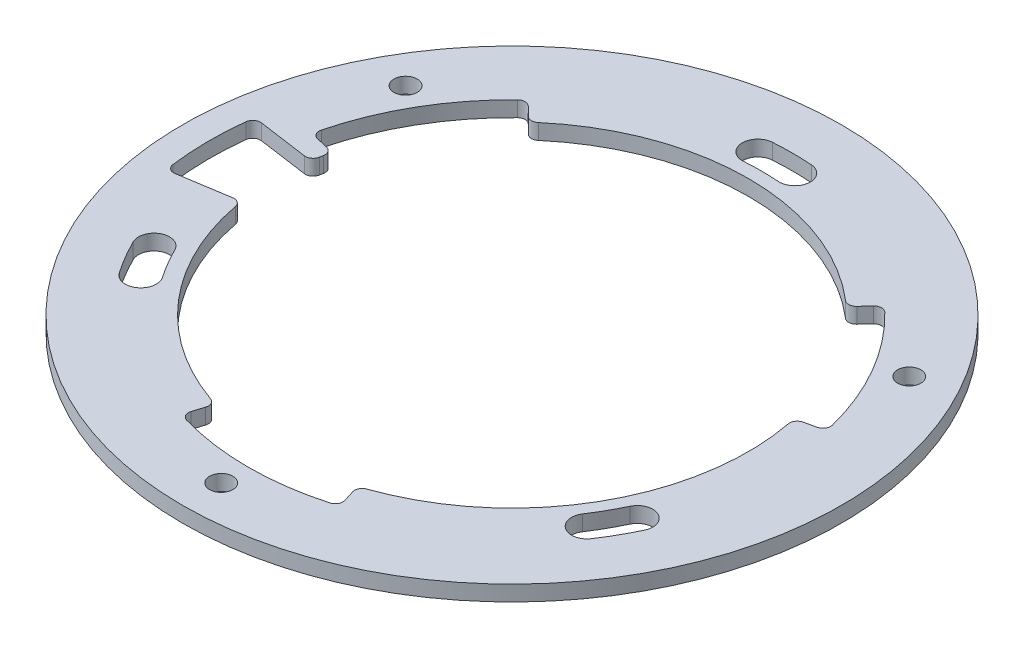
from build123d import *

# Parameters (mm, degrees)
SKETCH1_R           = 42.5
SKETCH1_R_2         = 30.5
SKETCH1_R_3         = 1.5
BOSS_EXTRUDE1_DEPTH = 2
SKETCH2_R           = 1.5
CUT_EXTRUDE1_DEPTH  = 61.137342808
CUT_EXTRUDE2_DEPTH  = 61.137342808
CUT_EXTRUDE3_DEPTH  = 61.137342808
FILLET1_R           = 1


with BuildPart() as part:
    # Sketch1 → Boss-Extrude1 (new body)
    with BuildSketch(Plane(origin=(0, 0, 0), x_dir=(1, 0, 0), z_dir=(0, 1, 0))):
        with Locations(Location((0, 0, 0), (0, 0, 270))):
            Circle(SKETCH1_R)
        with Locations(Location((0, 0, 0), (0, 0, 270))):
            Circle(SKETCH1_R_2, mode=Mode.SUBTRACT)
        with Locations(Location((0, 34.1739971, 0), (0, 0, 270))):
            Circle(SKETCH1_R_3, mode=Mode.SUBTRACT)
        with Locations(Location((-29.672696408, -17.456745562, 0), (0, 0, 270))):
            Circle(SKETCH1_R_3, mode=Mode.SUBTRACT)
        with Locations(Location((29.672696408, -16.717251537, 0), (0, 0, 270))):
            Circle(SKETCH1_R_3, mode=Mode.SUBTRACT)
        with Locations(Location((-32.475952642, 18.75, 0), (0, 0, 270))):
            Circle(SKETCH1_R_3, mode=Mode.SUBTRACT)
        with Locations(Location((0, -37.5, 0), (0, 0, 270))):
            Circle(SKETCH1_R_3, mode=Mode.SUBTRACT)
        with Locations(Location((32.475952642, 18.75, 0), (0, 0, 270))):
            Circle(SKETCH1_R_3, mode=Mode.SUBTRACT)
    extrude(amount=BOSS_EXTRUDE1_DEPTH)

    # Sketch2 → Cut-Extrude1 (cut, through all)
    # profile 1 of 3: a face of its own
    with BuildSketch(Plane(origin=(0, 2, 0), x_dir=(1, 0, 0), z_dir=(0, 1, 0))):
        with BuildLine():
            ThreePointArc((2.523370479, 36.085879061), (0, 36.1739971), (-2.523370479, 36.085879061))
            ThreePointArc((-2.523370479, 36.085879061), (-4.378985632, 33.951238013), (-2.244344584, 32.09562286))
            ThreePointArc((-2.244344584, 32.09562286), (0, 32.1739971), (2.244344584, 32.09562286))
            ThreePointArc((2.244344584, 32.09562286), (4.378985632, 33.951238013), (2.523370479, 36.085879061))
        make_face()
        with Locations((0, 34.1739971)):
            Circle(SKETCH2_R, mode=Mode.SUBTRACT)
    # profile 2 of 3: a face of its own
    with BuildSketch(Plane(origin=(0, 2, 0), x_dir=(1, 0, 0), z_dir=(0, 1, 0))):
        with BuildLine():
            ThreePointArc((-32.608491766, -16.235777693), (-31.396508518, -18.470881554), (-30.031564637, -20.615997137))
            ThreePointArc((-30.031564637, -20.615997137), (-27.250781536, -21.132954915), (-26.733823758, -18.352171814))
            ThreePointArc((-26.733823758, -18.352171814), (-27.948884299, -16.442609571), (-29.027780684, -14.452940586))
            ThreePointArc((-29.027780684, -14.452940586), (-31.709554778, -13.554003599), (-32.608491766, -16.235777693))
        make_face()
        with Locations((-29.672696408, -17.456745562)):
            Circle(SKETCH2_R, mode=Mode.SUBTRACT)
    # profile 3 of 3: a face of its own
    with BuildSketch(Plane(origin=(0, 2, 0), x_dir=(1, 0, 0), z_dir=(0, 1, 0))):
        with BuildLine():
            ThreePointArc((30.104043518, -19.847248501), (31.41518565, -17.69894968), (32.573276155, -15.464423355))
            ThreePointArc((32.573276155, -15.464423355), (31.6243086, -12.799942059), (28.959827303, -13.748909615))
            ThreePointArc((28.959827303, -13.748909615), (27.930207167, -15.735553395), (26.764513869, -17.64553514))
            ThreePointArc((26.764513869, -17.64553514), (27.333422013, -20.416156645), (30.104043518, -19.847248501))
        make_face()
        with Locations((29.672696408, -16.717251537)):
            Circle(SKETCH2_R, mode=Mode.SUBTRACT)
    extrude(amount=-CUT_EXTRUDE1_DEPTH, mode=Mode.SUBTRACT)

    # Sketch3 → Cut-Extrude2 (cut, through all)
    with BuildSketch(Plane(origin=(0, 2, 0), x_dir=(1, 0, 0), z_dir=(0, 1, 0))):
        with BuildLine():
            Line((-29.777028217, 6.601408225), (-33.194064242, 7.358946874))
            ThreePointArc((-33.194064242, 7.358946874), (-29.444863729, 17), (-22.970067059, 25.067429452))
            Line((-22.970067059, 25.067429452), (-20.492564537, 22.58992693))
            ThreePointArc((-20.492564537, 22.58992693), (-26.37548429, 15.316129684), (-29.777028217, 6.601408225))
        make_face()
        with BuildLine():
            Line((20.605501332, 22.486958773), (22.970067059, 25.067429452))
            ThreePointArc((22.970067059, 25.067429452), (29.444863729, 17), (33.194064242, 7.358946874))
            Line((33.194064242, 7.358946874), (29.777028217, 6.601408225))
            ThreePointArc((29.777028217, 6.601408225), (26.413774815, 15.25), (20.605501332, 22.486958773))
        make_face()
        with BuildLine():
            Line((-9.171526885, -29.088366998), (-10.223997183, -32.426376325))
            ThreePointArc((-10.223997183, -32.426376325), (0, -34), (10.223997183, -32.426376325))
            Line((10.223997183, -32.426376325), (9.171526885, -29.088366998))
            ThreePointArc((9.171526885, -29.088366998), (0, -30.5), (-9.171526885, -29.088366998))
        make_face()
    extrude(amount=-CUT_EXTRUDE2_DEPTH, mode=Mode.SUBTRACT)

    # Sketch4 → Cut-Extrude3 (cut, through all)
    with BuildSketch(Plane(origin=(0, 2, 0), x_dir=(1, 0, 0), z_dir=(0, 1, 0))):
        with BuildLine():
            Line((-30.200854727, 4.261264341), (-38.617486372, 5.448829814))
            ThreePointArc((-38.617486372, 5.448829814), (-38.998694951, -0.319048797), (-38.523169542, -6.079918457))
            Line((-38.523169542, -6.079918457), (-30.127094129, -4.754808024))
            ThreePointArc((-30.127094129, -4.754808024), (-30.498979385, -0.249512521), (-30.200854727, 4.261264341))
        make_face()
    extrude(amount=-CUT_EXTRUDE3_DEPTH, mode=Mode.SUBTRACT)

    # Fillet1
    fillet1_edges = [part.edges().sort_by_distance(p)[0] for p in [
        (-20.492564537, 1, -22.58992693),
        (-29.777028217, 1, -6.601408225),
        (-33.194064242, 1, -7.358946874),
        (-22.970067059, 1, -25.067429452),
        (-9.171526885, 1, 29.088366998),
        (9.171526885, 1, 29.088366998),
        (10.223997183, 1, 32.426376325),
        (-10.223997183, 1, 32.426376325),
        (22.970067059, 1, -25.067429452),
        (33.194064242, 1, -7.358946874),
        (29.777028217, 1, -6.601408225),
        (20.605501332, 1, -22.486958773),
        (-30.200854727, 1, -4.261264341),
        (-30.127094129, 1, 4.754808024),
        (-38.523169542, 1, 6.079918457),
        (-38.617486372, 1, -5.448829814),
    ]]
    fillet(fillet1_edges, radius=FILLET1_R)


solid = part.part
